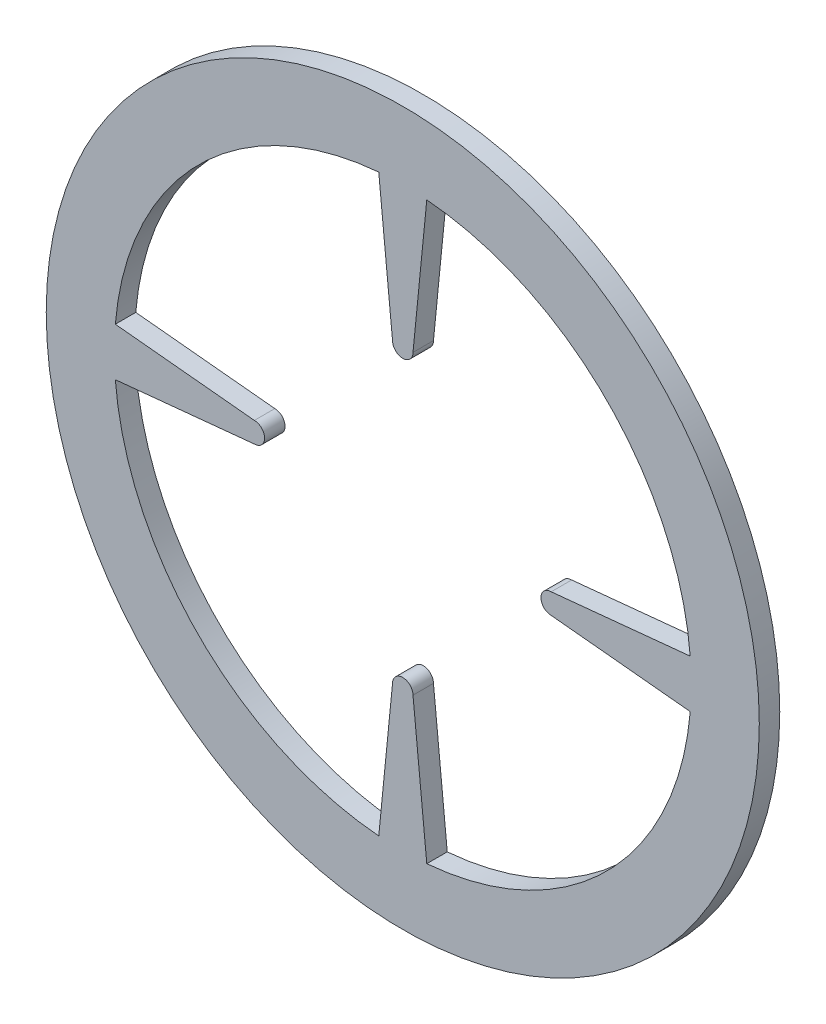
from build123d import *

# Parameters (mm, degrees)
SKETCH_1_R      = 1.045
EXTRUDE_1_DEPTH = 0.06


with BuildPart() as part:
    # 草圖1 → 填料-伸長1 (new body)
    with BuildSketch(Plane.XY):
        Circle(SKETCH_1_R)
        with BuildLine():
            Line((-0.070388149, 0.842515581), (-0.03, 0.435))
            ThreePointArc((-0.03, 0.435), (0, 0.405), (0.03, 0.435))
            Line((0.03, 0.435), (0.070388149, 0.842515581))
            ThreePointArc((0.070388149, 0.842515581), (0.597823969, 0.597823969), (0.842515581, 0.070388149))
            Line((0.842515581, 0.070388149), (0.435, 0.03))
            ThreePointArc((0.435, 0.03), (0.405, 0), (0.435, -0.03))
            Line((0.435, -0.03), (0.842515581, -0.070388149))
            ThreePointArc((0.842515581, -0.070388149), (0.597823969, -0.597823969), (0.070388149, -0.842515581))
            Line((0.070388149, -0.842515581), (0.03, -0.435))
            ThreePointArc((0.03, -0.435), (0, -0.405), (-0.03, -0.435))
            Line((-0.03, -0.435), (-0.070388149, -0.842515581))
            ThreePointArc((-0.070388149, -0.842515581), (-0.597823969, -0.597823969), (-0.842515581, -0.070388149))
            Line((-0.842515581, -0.070388149), (-0.435, -0.03))
            ThreePointArc((-0.435, -0.03), (-0.405, 0), (-0.435, 0.03))
            Line((-0.435, 0.03), (-0.842515581, 0.070388149))
            ThreePointArc((-0.842515581, 0.070388149), (-0.597823969, 0.597823969), (-0.070388149, 0.842515581))
        make_face(mode=Mode.SUBTRACT)
    extrude(amount=EXTRUDE_1_DEPTH)


solid = part.part
